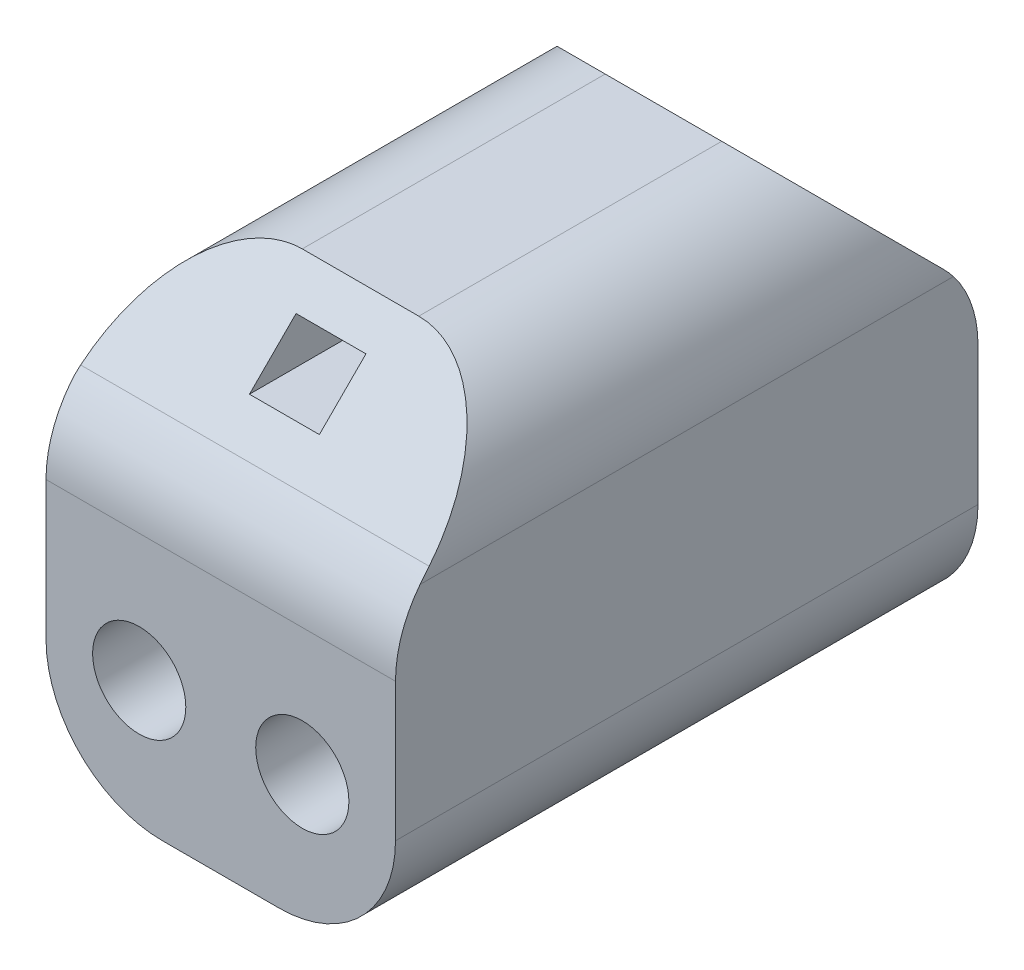
from build123d import *

# Parameters (mm, degrees)
BOSS_EXTRUDE1_DEPTH = 7.5
FILLET3_R           = 5
SKETCH4_R           = 2
SKETCH4_W           = 3
SKETCH4_H           = 2
CUT_EXTRUDE1_DEPTH  = 100
FILLET4_R           = 5
FILLET5_R           = 5


with BuildPart() as part:
    # Sketch1 → Boss-Extrude1 (new, symmetric)
    with BuildSketch(Plane(origin=(0, 0, 0), x_dir=(0, 0, -1), z_dir=(1, 0, 0))):
        Polygon((-31.324369962, -10.21673477), (-37.324369962, -16.21673477), (-37.324369962, -29.21673477), (-12.324369962, -29.21673477), (-12.324369962, -16.21673477), (-18.324369962, -10.21673477), align=None)
    extrude(amount=BOSS_EXTRUDE1_DEPTH, both=True)

    # Fillet3
    fillet3_edges = [part.edges().sort_by_distance(p)[0] for p in [
        (0, -16.21673477, 12.324369962),
        (0, -16.21673477, 37.324369962),
    ]]
    fillet(fillet3_edges, radius=FILLET3_R)

    # Sketch4 → Cut-Extrude1 (cut, symmetric)
    with BuildSketch(Plane.XY):
        with Locations((-3.5, -23.752268676)):
            Circle(SKETCH4_R)
        with Locations((3.5, -23.752268676)):
            Circle(SKETCH4_R)
        with Locations((0, -12.484501723)):
            Rectangle(SKETCH4_W, SKETCH4_H)
    extrude(amount=CUT_EXTRUDE1_DEPTH, both=True, mode=Mode.SUBTRACT)

    # Fillet4
    fillet4_edges = [part.edges().sort_by_distance(p)[0] for p in [
        (7.5, -29.21673477, 24.824369962),
        (-7.5, -29.21673477, 24.824369962),
    ]]
    fillet(fillet4_edges, radius=FILLET4_R)

    # Fillet5
    fillet5_edges = [part.edges().sort_by_distance(p)[0] for p in [
        (7.5, -10.21673477, 24.824369962),
        (-7.5, -10.21673477, 24.824369962),
    ]]
    fillet(fillet5_edges, radius=FILLET5_R)


solid = part.part
